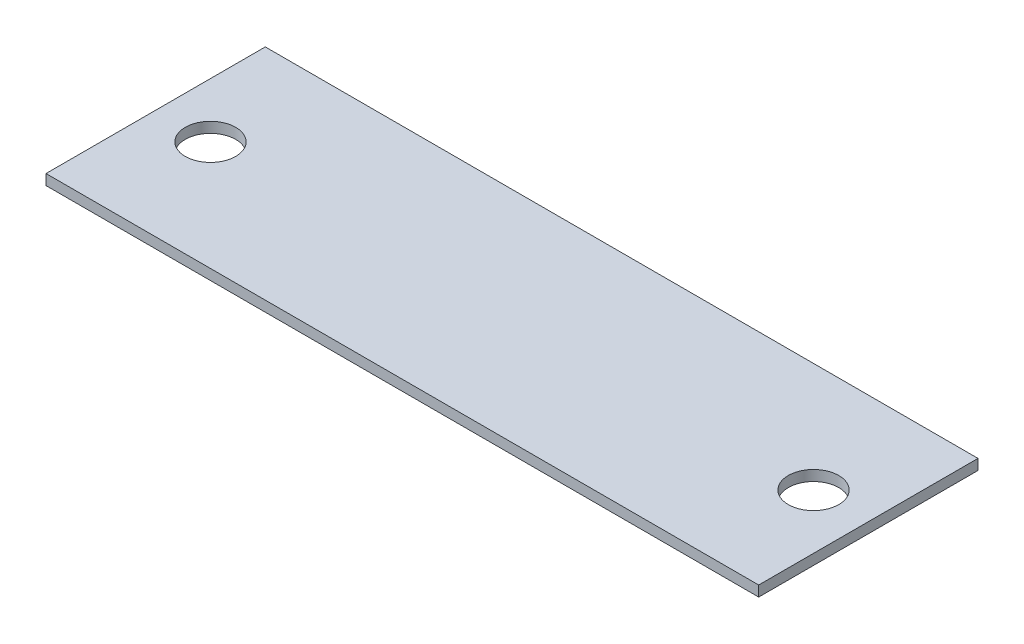
from build123d import *

# Parameters (mm, degrees)
SKETCH1_W           = 82.55
SKETCH1_H           = 25.4
SKETCH1_R           = 2.921
BOSS_EXTRUDE1_DEPTH = 1.1176
MOVE_FACE2_BY       = 0.09652


with BuildPart() as part:
    # Sketch1 → Boss-Extrude1 (new body)
    with BuildSketch(Plane(origin=(0, 0, 0), x_dir=(1, 0, 0), z_dir=(0, 1, 0))):
        Rectangle(SKETCH1_W, SKETCH1_H)
        with Locations(Location((-34.925, 0, 0), (0, 0, 270))):
            Circle(SKETCH1_R, mode=Mode.SUBTRACT)
        with Locations(Location((34.925, 0, 0), (0, 0, 270))):
            Circle(SKETCH1_R, mode=Mode.SUBTRACT)
    extrude(amount=BOSS_EXTRUDE1_DEPTH)

    # Move Face2: a face moved outward by 0.09652
    extrude(part.faces().sort_by_distance((0, 1.1176, 0))[0], amount=MOVE_FACE2_BY, dir=(0, 1, 0))


solid = part.part
